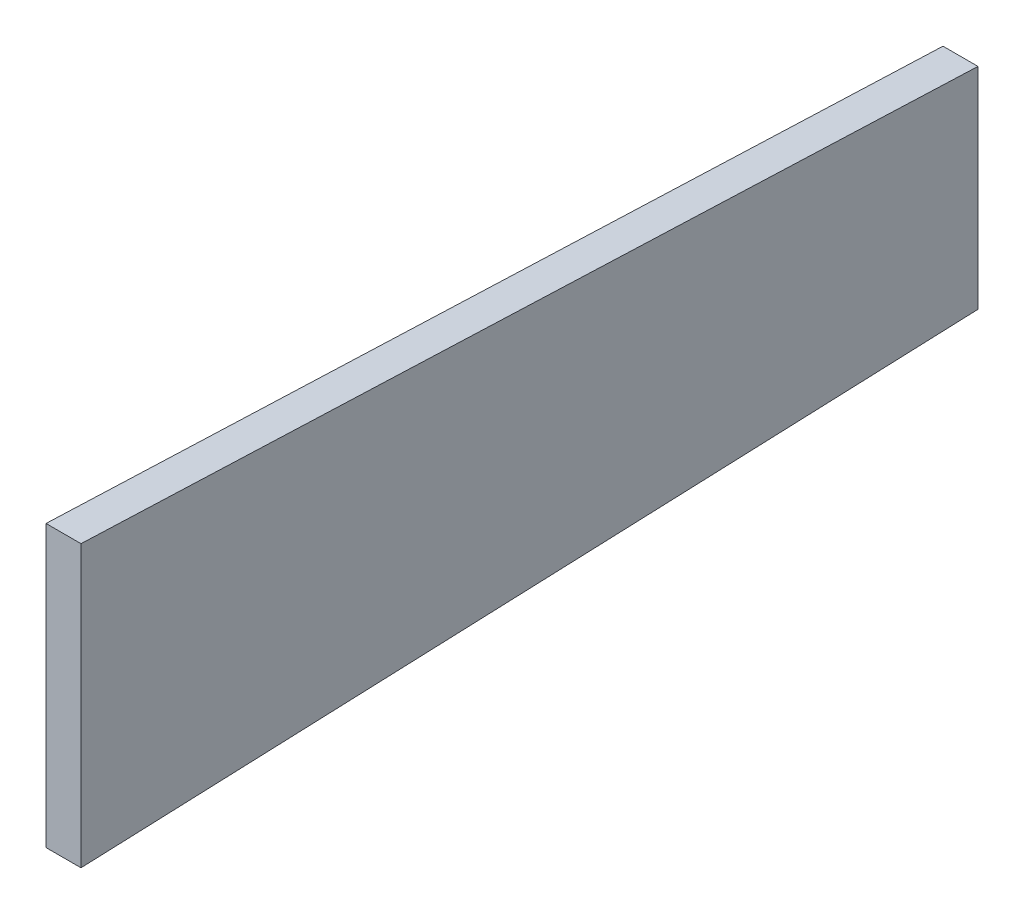
from build123d import *

# Parameters (mm, degrees)
BOSS_EXTRUDE1_DEPTH = 4


with BuildPart() as part:
    # Sketch1 → Boss-Extrude1 (new body)
    with BuildSketch(Plane(origin=(0, 0, 0), x_dir=(0, 0, -1), z_dir=(1, 0, 0))):
        Polygon((-90, 16.039145957), (-90, -16.039145957), (12.5, -12.019395168), (12.5, 12.019395168), align=None)
    extrude(amount=BOSS_EXTRUDE1_DEPTH)


solid = part.part
